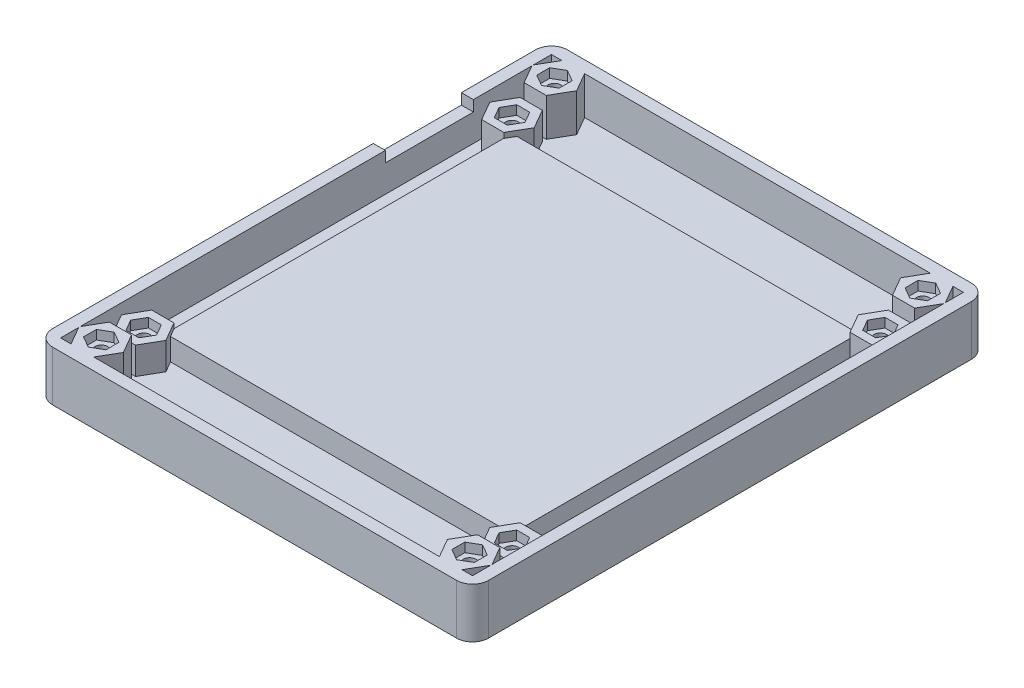
from build123d import *

# Parameters (mm, degrees)
P_IDAT_VYSUNUT_M25_DEPTH      = 3
P_IDAT_VYSUNUT_M26_DEPTH      = 9.5
P_IDAT_VYSUNUT_M26_DEPTH_BACK = 3
SKICA1_21_W                   = 108.885125168
SKICA1_21_H                   = 128.6
SKICA1_21_W_2                 = 102.885125168
SKICA1_21_H_2                 = 122.6
P_IDAT_VYSUNUT_M28_DEPTH      = 6.8
SKICA1_24_R                   = 1.6
P_IDAT_VYSUNUT_M29_DEPTH      = 4.5
LINPOLE3_COUNT                = 2
LINPOLE3_PITCH                = 92
LINPOLE3_COUNT_DIR2           = 2
LINPOLE3_PITCH_DIR2           = 92
P_IDAT_VYSUNUT_M30_DEPTH      = 9.5
SKICA1_26_R                   = 1.6
P_IDAT_VYSUNUT_M31_DEPTH      = 7.2
LINPOLE4_COUNT                = 2
LINPOLE4_PITCH                = 92
LINPOLE4_COUNT_DIR2           = 2
LINPOLE4_PITCH_DIR2           = 113.2
SKICA8_W                      = 86.538297386
SKICA8_H                      = 86.538297386
P_IDAT_VYSUNUT_M32_DEPTH      = 5.5
ZAOBLIT4_R                    = 4
SKICA9_W                      = 22
SKICA9_H                      = 2.7
ODEBRAT_VYSUNUT_M1_DEPTH      = 10


with BuildPart() as part:
    # Skica1 → Přidat vysunutím25 (new body)
    with BuildSketch(Plane(origin=(0, 0, 0), x_dir=(1, 0, 0), z_dir=(0, 1, 0))):
        Polygon((51.442562584, 61.3), (-43.170983681, 61.3), (-43.228718708, 61.4), (-48.771281292, 61.4), (-48.829016319, 61.3), (-51.442562584, 61.3), (-51.442562584, 56.773205081), (-51.542562584, 56.6), (-51.442562584, 56.426794919), (-51.442562584, 46.173205081), (-51.542562584, 46), (-51.442562584, 45.826794919), (-51.442562584, -61.3), (51.442562584, -61.3), align=None)
    extrude(amount=-P_IDAT_VYSUNUT_M25_DEPTH)

    # Skica1<21> → Přidat vysunutím26 (add, two sides: drawn at the far end of the back side and taken through both)
    with BuildSketch(Plane(origin=(0, 0, 0), x_dir=(1, 0, 0), z_dir=(0, 1, 0)).offset(-P_IDAT_VYSUNUT_M26_DEPTH_BACK)):
        Rectangle(SKICA1_21_W, SKICA1_21_H)
        Rectangle(SKICA1_21_W_2, SKICA1_21_H_2, mode=Mode.SUBTRACT)
    extrude(amount=P_IDAT_VYSUNUT_M26_DEPTH + P_IDAT_VYSUNUT_M26_DEPTH_BACK)

    # Skica1<23> → Přidat vysunutím28 (add)
    with BuildSketch(Plane(origin=(0, 0, 0), x_dir=(1, 0, 0), z_dir=(0, 1, 0))):
        Polygon((-48.771281292, 41.2), (-43.228718708, 41.2), (-40.457437416, 46), (-43.228718708, 50.8), (-48.771281292, 50.8), (-51.542562584, 46), align=None)
        Polygon((-44.383419246, 43.2), (-47.616580754, 43.2), (-49.233161507, 46), (-47.616580754, 48.8), (-44.383419246, 48.8), (-42.766838493, 46), align=None, mode=Mode.SUBTRACT)
    p_idat_vysunut_m28 = extrude(amount=P_IDAT_VYSUNUT_M28_DEPTH)

    # Skica1<24> → Přidat vysunutím29 (add)
    with BuildSketch(Plane(origin=(0, 0, 0), x_dir=(1, 0, 0), z_dir=(0, 1, 0))):
        Polygon((-49.233161507, 46), (-47.616580754, 43.2), (-44.383419246, 43.2), (-42.766838493, 46), (-44.383419246, 48.8), (-47.616580754, 48.8), align=None)
        with Locations((-46, 46)):
            Circle(SKICA1_24_R, mode=Mode.SUBTRACT)
    p_idat_vysunut_m29 = extrude(amount=P_IDAT_VYSUNUT_M29_DEPTH)

    # LinPole3: Přidat vysunutím28, P_idat vysunut_m29 2 × 2
    with Locations(*[(i * LINPOLE3_PITCH, 0, j * LINPOLE3_PITCH_DIR2) for i in range(LINPOLE3_COUNT) for j in range(LINPOLE3_COUNT_DIR2) if (i, j) != (0, 0)]):
        add(p_idat_vysunut_m28)
        add(p_idat_vysunut_m29)

    # Skica1<25> → Přidat vysunutím30 (add)
    with BuildSketch(Plane(origin=(0, 0, 0), x_dir=(1, 0, 0), z_dir=(0, 1, 0))):
        Polygon((-51.542562584, 56.6), (-48.771281292, 51.8), (-43.228718708, 51.8), (-40.457437416, 56.6), (-43.228718708, 61.4), (-48.771281292, 61.4), align=None)
        Polygon((-43.2, 54.983419246), (-46, 53.366838493), (-48.8, 54.983419246), (-48.8, 58.216580754), (-46, 59.833161507), (-43.2, 58.216580754), align=None, mode=Mode.SUBTRACT)
    p_idat_vysunut_m30 = extrude(amount=P_IDAT_VYSUNUT_M30_DEPTH)

    # Skica1<26> → Přidat vysunutím31 (add)
    with BuildSketch(Plane(origin=(0, 0, 0), x_dir=(1, 0, 0), z_dir=(0, 1, 0))):
        Polygon((-48.8, 54.983419246), (-46, 53.366838493), (-43.2, 54.983419246), (-43.2, 58.216580754), (-46, 59.833161507), (-48.8, 58.216580754), align=None)
        with Locations((-46, 56.6)):
            Circle(SKICA1_26_R, mode=Mode.SUBTRACT)
    p_idat_vysunut_m31 = extrude(amount=P_IDAT_VYSUNUT_M31_DEPTH)

    # LinPole4: Přidat vysunutím30, P_idat vysunut_m31 2 × 2
    with Locations(*[(i * LINPOLE4_PITCH, 0, j * LINPOLE4_PITCH_DIR2) for i in range(LINPOLE4_COUNT) for j in range(LINPOLE4_COUNT_DIR2) if (i, j) != (0, 0)]):
        add(p_idat_vysunut_m30)
        add(p_idat_vysunut_m31)

    # Skica8 → Přidat vysunutím32 (add)
    with BuildSketch(Plane(origin=(0, 0, 0), x_dir=(1, 0, 0), z_dir=(0, 1, 0))):
        Rectangle(SKICA8_W, SKICA8_H)
    extrude(amount=P_IDAT_VYSUNUT_M32_DEPTH)

    # Zaoblit4
    zaoblit4_edges = [part.edges().sort_by_distance(p)[0] for p in [
        (-54.442562584, 3.25, 64.3),
        (54.442562584, 3.25, 64.3),
        (54.442562584, 3.25, -64.3),
        (-54.442562584, 3.25, -64.3),
    ]]
    fillet(zaoblit4_edges, radius=ZAOBLIT4_R)

    # Skica9 → Odebrat vysunutím1 (cut)
    with BuildSketch(Plane.ZY.offset(54.442562584)):
        with Locations((-30.8, 8.15)):
            Rectangle(SKICA9_W, SKICA9_H)
    extrude(amount=-ODEBRAT_VYSUNUT_M1_DEPTH, mode=Mode.SUBTRACT)


solid = part.part
